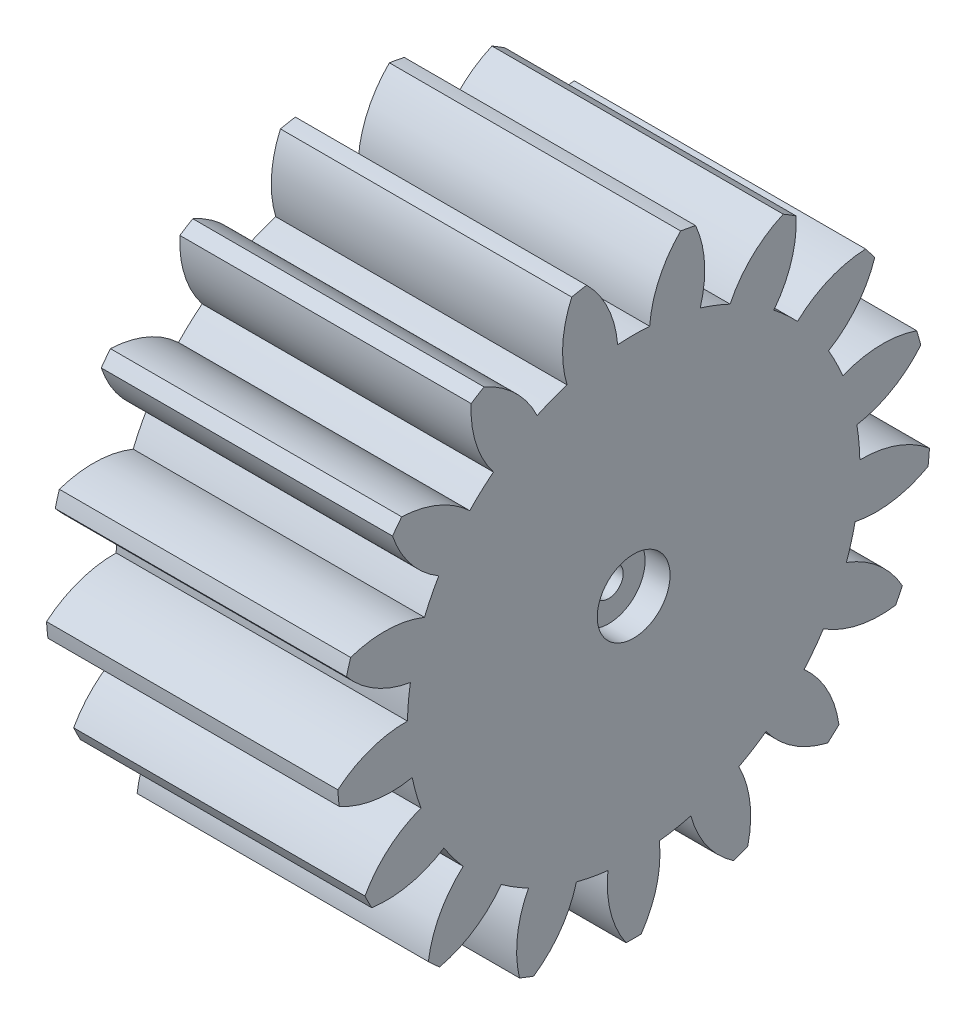
from build123d import *

# Parameters (mm, degrees)
BASPROSKE_W                              = 28
BASPROSKE_H                              = 28.5
TOOTHCUT_DEPTH                           = 50.076470941
TEETHCUTS_COUNT                          = 17
TEETHCUTS_ANGLE                          = 338.823529412
BORSKE_R                                 = 0.4
BORE_DEPTH                               = 50.0000508
CUT_EXTRUDE1_DEPTH                       = 21
CBORE_FOR_M3_PAN_HEAD_SCREW1_D           = 2.8
CBORE_FOR_M3_PAN_HEAD_SCREW1_CBORE_D     = 7
CBORE_FOR_M3_PAN_HEAD_SCREW1_CBORE_DEPTH = 2.4
FILLET1_R                                = 0.5


with BuildPart() as part:
    # BasProSke → Base-Revolve (revolve)
    with BuildSketch(Plane(origin=(0, 0, 0), x_dir=(1, 0, 0), z_dir=(0, 1, 0)), mode=Mode.PRIVATE) as base_revolve_sk:
        with Locations((14, 14.25)):
            Rectangle(BASPROSKE_W, BASPROSKE_H)
    revolve(base_revolve_sk.sketch.rotate(Axis((-10, 0, 0), (1, 0, 0)), 180), axis=Axis((-10, 0, 0), (1, 0, 0)))

    # TooCutSke → ToothCut (cut, through all)
    with BuildSketch(Plane(origin=(0, 0, 0), x_dir=(0, 0, -1), z_dir=(1, 0, 0))):
        with BuildLine():
            ThreePointArc((1.540279816, 21.694389576), (0, 21.749), (-1.540279816, 21.694389576))
            ThreePointArc((-1.540279816, 21.694389576), (-2.457007956, 25.198716871), (-4.540621854, 28.161697363))
            ThreePointArc((-4.540621854, 28.161697363), (0, 28.5254), (4.540621854, 28.161697363))
            ThreePointArc((4.540621854, 28.161697363), (2.457007956, 25.198716871), (1.540279816, 21.694389576))
        make_face()
    toothcut = extrude(amount=TOOTHCUT_DEPTH, mode=Mode.SUBTRACT)

    # TeethCuts: ToothCut ×17 about axis
    teethcuts_axis = Axis((-10, 0, 0), (1, 0, 0))
    for i in range(1, TEETHCUTS_COUNT):
        add(toothcut.rotate(teethcuts_axis, i * TEETHCUTS_ANGLE / (TEETHCUTS_COUNT - 1)), mode=Mode.SUBTRACT)

    # BorSke → Bore (cut, symmetric)
    with BuildSketch(Plane(origin=(0, 0, 0), x_dir=(0, 0, -1), z_dir=(1, 0, 0))):
        with Locations(Location((0, 0, 0), (0, 0, 180))):
            Circle(BORSKE_R)
    extrude(amount=BORE_DEPTH, both=True, mode=Mode.SUBTRACT)

    # Sketch1 → Cut-Extrude1 (cut)
    with BuildSketch(Plane.ZY):
        Polygon((0, -7.5), (6.495190528, -3.75), (6.495190528, 3.75), (0, 7.5), (-6.495190528, 3.75), (-6.495190528, -3.75), align=None)
    extrude(amount=-CUT_EXTRUDE1_DEPTH, mode=Mode.SUBTRACT)

    # CBORE for M3 Pan Head Screw1 (through all)
    with Locations(Plane(origin=(28, 0, 0), x_dir=(0, 0, -1), z_dir=(1, 0, 0))):
        with Locations((0, 0)):
            CounterBoreHole(CBORE_FOR_M3_PAN_HEAD_SCREW1_D / 2, CBORE_FOR_M3_PAN_HEAD_SCREW1_CBORE_D / 2, CBORE_FOR_M3_PAN_HEAD_SCREW1_CBORE_DEPTH)

    # Fillet1
    fillet1_edges = [part.edges().sort_by_distance(p)[0] for p in [
        (10.5, -7.5, 0),
        (10.5, -3.75, -6.495190528),
        (10.5, 3.75, -6.495190528),
        (10.5, 7.5, 0),
        (10.5, 3.75, 6.495190528),
        (10.5, -3.75, 6.495190528),
        (0, -5.625, -3.247595264),
        (0, -5.625, 3.247595264),
        (0, 0, 6.495190528),
        (0, 5.625, 3.247595264),
        (0, 5.625, -3.247595264),
        (0, 0, -6.495190528),
    ]]
    fillet(fillet1_edges, radius=FILLET1_R)


solid = part.part
